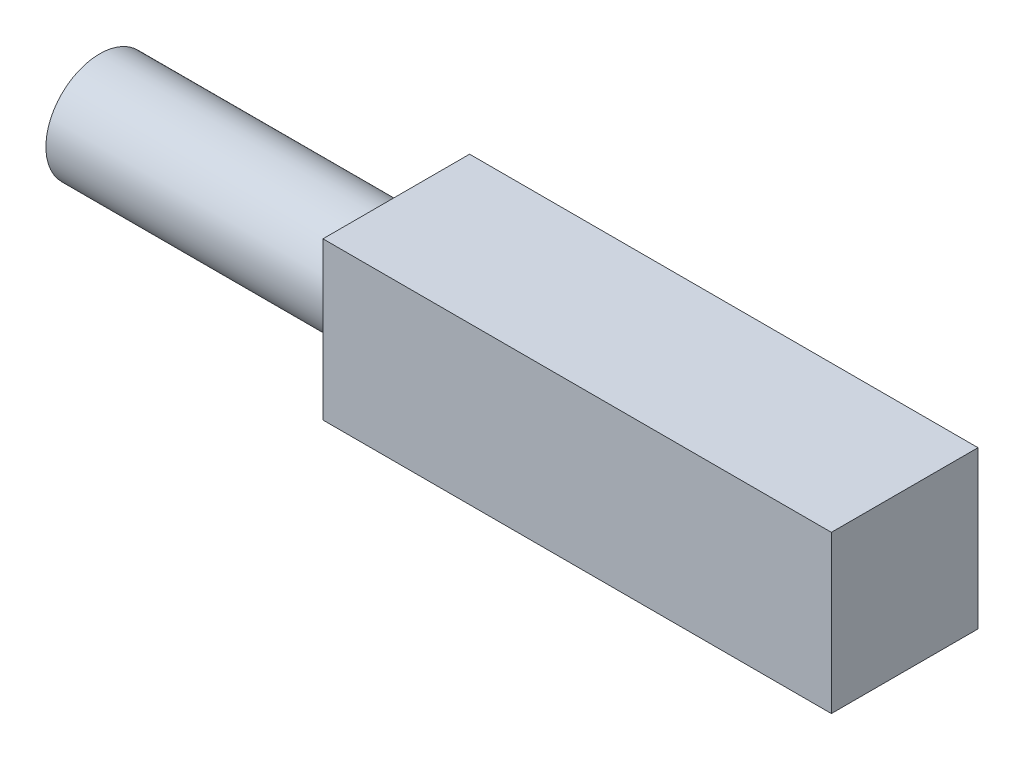
from build123d import *

# Parameters (mm, degrees)
SKETCH1_R           = 12.7
BOSS_EXTRUDE1_DEPTH = 70
SKETCH2_W           = 37.050168224
SKETCH2_H           = 34.6077549
BOSS_EXTRUDE2_DEPTH = 120


with BuildPart() as part:
    # Sketch1 → Boss-Extrude1 (new body)
    with BuildSketch(Plane.YZ):
        with Locations(Location((0, 0, 0), (0, 0, 270))):
            Circle(SKETCH1_R)
    extrude(amount=BOSS_EXTRUDE1_DEPTH)

    # Sketch2 → Boss-Extrude2 (add)
    with BuildSketch(Plane.YZ.offset(70)):
        Rectangle(SKETCH2_W, SKETCH2_H)
    extrude(amount=BOSS_EXTRUDE2_DEPTH)


solid = part.part
